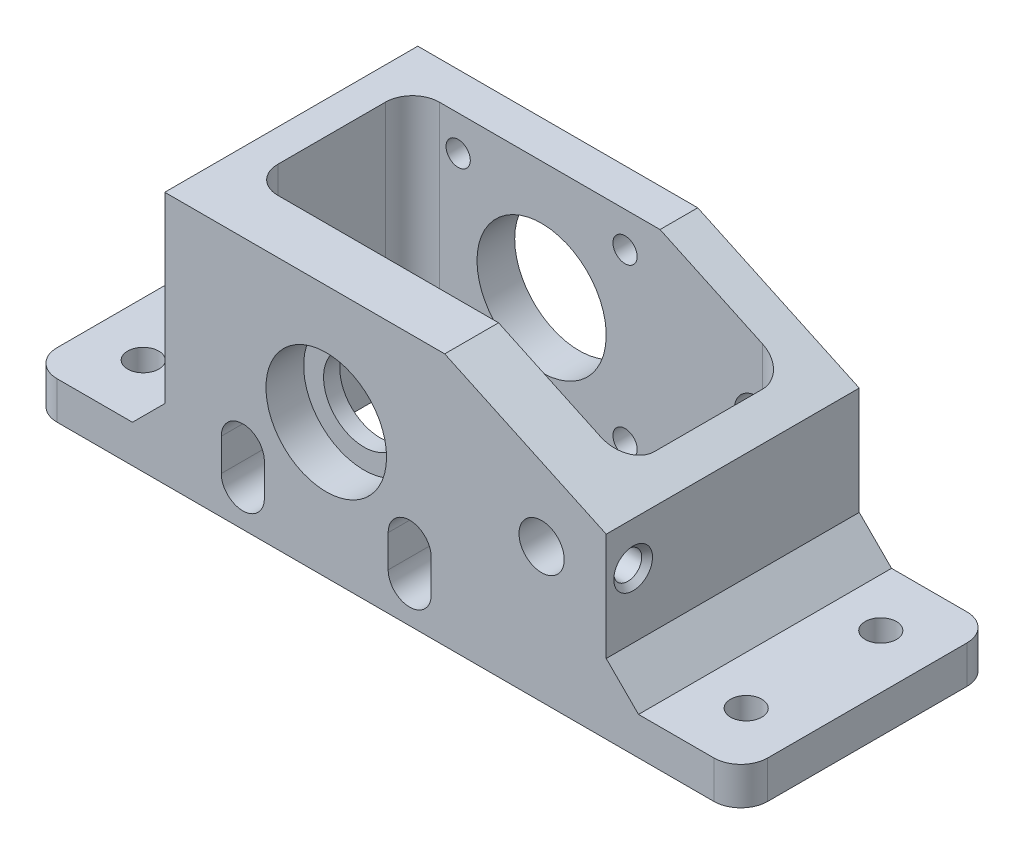
from build123d import *

# Parameters (mm, degrees)
SKETCH1_R                     = 7.5
SKETCH1_R_2                   = 4.2
BOSS_EXTRUDE1_DEPTH           = 47
SKETCH2_R                     = 11.2
CUT_EXTRUDE1_DEPTH            = 7
SKETCH3_R                     = 2.25
SKETCH3_R_2                   = 12
CUT_EXTRUDE2_DEPTH            = 15
CUT_EXTRUDE3_DEPTH            = 85.391942743
CUT_EXTRUDE4_DEPTH            = 20
SKETCH7_R                     = 2.6
CUT_EXTRUDE5_DEPTH            = 10
CHAMFER2_SIZE                 = 1
SKETCH9_W                     = 25
SKETCH9_H                     = 47
BOSS_EXTRUDE2_DEPTH           = 7
BOSS_EXTRUDE2_2_DEPTH         = 7
SKETCH10_W                    = 2.9
SKETCH10_H                    = 7
M5_CLEARANCE_HOLE1_AT_2_COUNT = 2
M5_CLEARANCE_HOLE1_AT_2_PITCH = 25
M5_CLEARANCE_HOLE1_AT_3_COUNT = 2
M5_CLEARANCE_HOLE1_AT_3_PITCH = 114.756263446
M5_CLEARANCE_HOLE1_AT_4_COUNT = 2
M5_CLEARANCE_HOLE1_AT_4_PITCH = 112
BOSS_EXTRUDE3_DEPTH           = 47
FILLET1_R                     = 5


with BuildPart() as part:
    # Sketch1 → Boss-Extrude1 (new body)
    with BuildSketch(Plane.XY):
        Polygon((-30, -25), (-30, 22), (22, 22), (52, 8), (52, -25), align=None)
        Circle(SKETCH1_R, mode=Mode.SUBTRACT)
        with Locations((40, 0)):
            Circle(SKETCH1_R_2, mode=Mode.SUBTRACT)
    extrude(amount=BOSS_EXTRUDE1_DEPTH)

    # Sketch2 → Cut-Extrude1 (cut)
    with BuildSketch(Plane.XY.offset(47)):
        Circle(SKETCH2_R)
    extrude(amount=-CUT_EXTRUDE1_DEPTH, mode=Mode.SUBTRACT)

    # Sketch3 → Cut-Extrude2 (cut)
    with BuildSketch(Plane(origin=(0, 0, 0), x_dir=(-1, 0, 0), z_dir=(0, 0, -1))):
        with Locations((-15.5, 15.5)):
            Circle(SKETCH3_R)
        with Locations((-15.5, -15.5)):
            Circle(SKETCH3_R)
        with Locations((15.5, -15.5)):
            Circle(SKETCH3_R)
        with Locations((15.5, 15.5)):
            Circle(SKETCH3_R)
        Circle(SKETCH3_R_2)
    extrude(amount=-CUT_EXTRUDE2_DEPTH, mode=Mode.SUBTRACT)

    # Sketch4 → Cut-Extrude3 (cut, through all)
    with BuildSketch(Plane(origin=(0, 22, 0), x_dir=(1, 0, 0), z_dir=(0, 1, 0))):
        with BuildLine():
            Line((-19, -7), (41, -7))
            ThreePointArc((41, -7), (44.535533906, -8.464466094), (46, -12))
            Line((46, -12), (46, -32))
            ThreePointArc((46, -32), (44.535533906, -35.535533906), (41, -37))
            Line((41, -37), (-19, -37))
            ThreePointArc((-19, -37), (-22.535533906, -35.535533906), (-24, -32))
            Line((-24, -32), (-24, -12))
            ThreePointArc((-24, -12), (-22.535533906, -8.464466094), (-19, -7))
        make_face()
    extrude(amount=-CUT_EXTRUDE3_DEPTH, mode=Mode.SUBTRACT)

    # Sketch6 → Cut-Extrude4 (cut)
    with BuildSketch(Plane.XY.offset(47)):
        with BuildLine():
            Line((-19.5, -12), (-19.5, -18))
            ThreePointArc((-19.5, -18), (-15.5, -22), (-11.5, -18))
            Line((-11.5, -18), (-11.5, -12))
            ThreePointArc((-11.5, -12), (-15.5, -8), (-19.5, -12))
        make_face()
        with BuildLine():
            Line((11.5, -12), (11.5, -18))
            ThreePointArc((11.5, -18), (15.5, -22), (19.5, -18))
            Line((19.5, -18), (19.5, -12))
            ThreePointArc((19.5, -12), (15.5, -8), (11.5, -12))
        make_face()
    extrude(amount=-CUT_EXTRUDE4_DEPTH, mode=Mode.SUBTRACT)

    # Sketch7 → Cut-Extrude5 (cut)
    with BuildSketch(Plane(origin=(52, 0, 0), x_dir=(0, 0, -1), z_dir=(1, 0, 0))):
        with Locations(Location((-42, 0, 0), (0, 0, 90))):
            Circle(SKETCH7_R)
    extrude(amount=-CUT_EXTRUDE5_DEPTH, mode=Mode.SUBTRACT)

    # Chamfer2
    chamfer2_edges = [part.edges().sort_by_distance(p)[0] for p in [
        (52, -2.6, 42),
    ]]
    chamfer(chamfer2_edges, length=CHAMFER2_SIZE)



with BuildPart() as body_2:
    # Sketch9 → Boss-Extrude2 (new body)
    with BuildSketch(Plane.XZ.offset(25)):
        with Locations((-42.5, 23.5)):
            Rectangle(SKETCH9_W, SKETCH9_H)
    extrude(amount=-BOSS_EXTRUDE2_DEPTH)

    # Sketch10 → M5 Clearance Hole1 (revolve, cut)
    with BuildSketch(Plane(origin=(-45, -18, 36), x_dir=(0, 0, 1), z_dir=(1, 0, 0))):
        with Locations((1.45, 3.5)):
            Rectangle(SKETCH10_W, SKETCH10_H)
    m5_clearance_hole1 = revolve(axis=Axis((-45, -11.65, 36), (0, -1, 0)), mode=Mode.SUBTRACT)

    # M5 Clearance Hole1 at 2: M5 Clearance Hole1 ×2
    with Locations(*[(0, 0, -i * M5_CLEARANCE_HOLE1_AT_2_PITCH) for i in range(1, M5_CLEARANCE_HOLE1_AT_2_COUNT)]):
        add(m5_clearance_hole1, mode=Mode.SUBTRACT)


with BuildPart() as body_3:
    # Sketch9 → Boss-Extrude2 2 (new body)
    with BuildSketch(Plane.XZ.offset(25)):
        with Locations((64.5, 23.5)):
            Rectangle(SKETCH9_W, SKETCH9_H)
    extrude(amount=-BOSS_EXTRUDE2_2_DEPTH)

    # M5 Clearance Hole1 at 3: M5 Clearance Hole1 ×2
    with Locations(*[Vector(0.9759815859905214, 0, -0.21785303258717012) * (i * M5_CLEARANCE_HOLE1_AT_3_PITCH) for i in range(1, M5_CLEARANCE_HOLE1_AT_3_COUNT)]):
        add(m5_clearance_hole1, mode=Mode.SUBTRACT)

    # M5 Clearance Hole1 at 4: M5 Clearance Hole1 ×2
    with Locations(*[(i * M5_CLEARANCE_HOLE1_AT_4_PITCH, 0, 0) for i in range(1, M5_CLEARANCE_HOLE1_AT_4_COUNT)]):
        add(m5_clearance_hole1, mode=Mode.SUBTRACT)


with BuildPart() as part_1:
    add(part.part)

    add(body_2.part)  # Boss-Extrude3 merges body 2

    add(body_3.part)  # Boss-Extrude3 merges body 3
    # Sketch13 → Boss-Extrude3 (add)
    with BuildSketch(Plane(origin=(0, 0, 0), x_dir=(-1, 0, 0), z_dir=(0, 0, -1))):
        Polygon((-52, -18), (-58, -18), (-52, -12), align=None)
        Polygon((30, -18), (30, -12), (36, -18), align=None)
    extrude(amount=-BOSS_EXTRUDE3_DEPTH)

    # Fillet1
    fillet1_edges = [part_1.edges().sort_by_distance(p)[0] for p in [
        (-55, -21.5, 47),
        (-55, -21.5, 0),
        (77, -21.5, 0),
        (77, -21.5, 47),
    ]]
    fillet(fillet1_edges, radius=FILLET1_R)


solid = part_1.part
